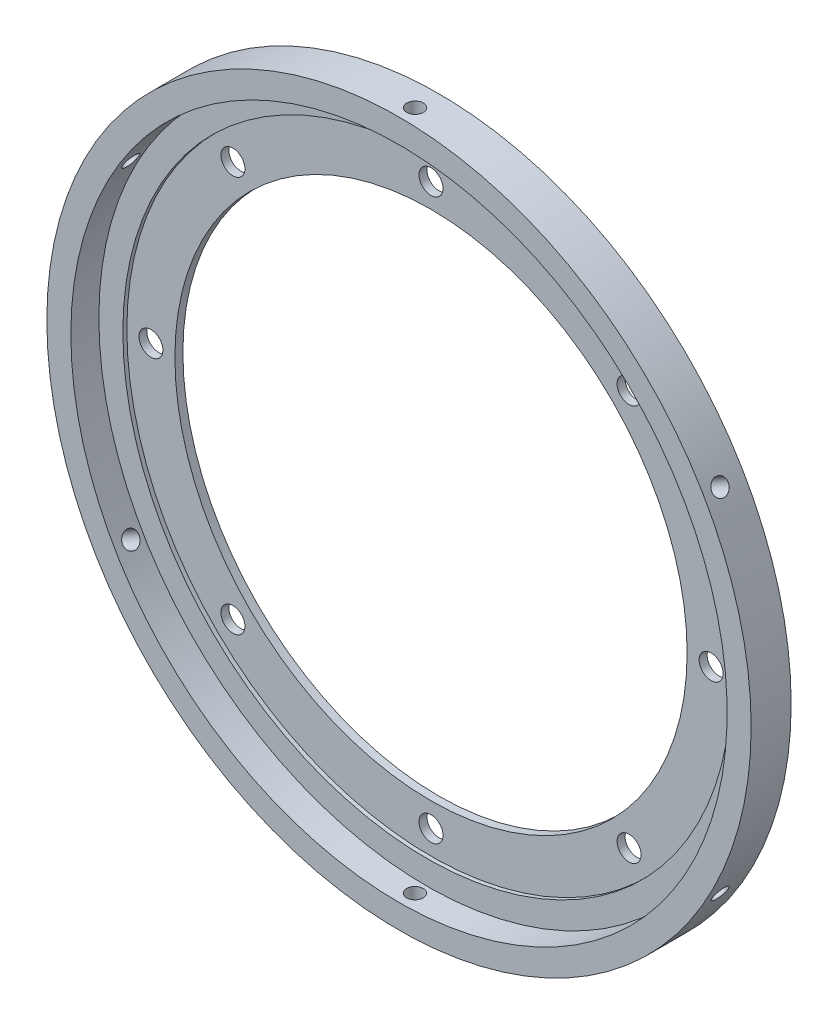
from build123d import *

# Parameters (mm, degrees)
CIRPATTERN1_COUNT = 8
CIRPATTERN2_COUNT = 6


with BuildPart() as part:
    # Sketch1 → Revolve1 (revolve)
    with BuildSketch(Plane(origin=(0, 0, 0), x_dir=(0, 0, -1), z_dir=(1, 0, 0)), mode=Mode.PRIVATE) as revolve1_sk:
        Polygon((0, 32), (0, 44), (-5, 44), (-5, 41), (-1.5, 41), (-1.5, 38), (-1, 38), (-1, 32), align=None)
    revolve(revolve1_sk.sketch.rotate(Axis((0, 0, 0), (0, 0, 1)), 90), axis=Axis((0, 0, 0), (0, 0, 1)))

    # Sketch2 → Ø3.0 (3) Diameter Hole1 (revolve, cut)
    with BuildSketch(Plane(origin=(0, 35, 1), x_dir=(0, -1, 0), z_dir=(1, 0, 0))):
        Polygon((0, 0), (0, 2.401290929), (1.5, 1.5), (1.5, 0), align=None)
    f_3_0_3_diameter_hole1 = revolve(axis=Axis((0, 35, 7.35), (0, 0, -1)), mode=Mode.SUBTRACT)

    # CirPattern1: Ø3.0 (3) Diameter Hole1 ×8 about axis
    cirpattern1_axis = Axis((0, 0, 0), (0, 0, 1))
    for i in range(1, CIRPATTERN1_COUNT):
        add(f_3_0_3_diameter_hole1.rotate(cirpattern1_axis, i * 360 / CIRPATTERN1_COUNT), mode=Mode.SUBTRACT)

    # Sketch4 → M2.5x0.45 Tapped Hole1 (revolve, cut)
    with BuildSketch(Plane(origin=(0, 44, 3), x_dir=(0, 0, 1), z_dir=(1, 0, 0))):
        Polygon((0, 0), (0, 6.965882135), (1.025, 6.35), (1.025, 0), align=None)
    m2_5x0_45_tapped_hole1 = revolve(axis=Axis((0, 50.35, 3), (0, -1, 0)), mode=Mode.SUBTRACT)

    # CirPattern2: M2.5x0.45 Tapped Hole1 ×6 about axis
    cirpattern2_axis = Axis((0, 0, 5.25), (0, 0, -1))
    for i in range(1, CIRPATTERN2_COUNT):
        add(m2_5x0_45_tapped_hole1.rotate(cirpattern2_axis, i * 360 / CIRPATTERN2_COUNT), mode=Mode.SUBTRACT)


solid = part.part
